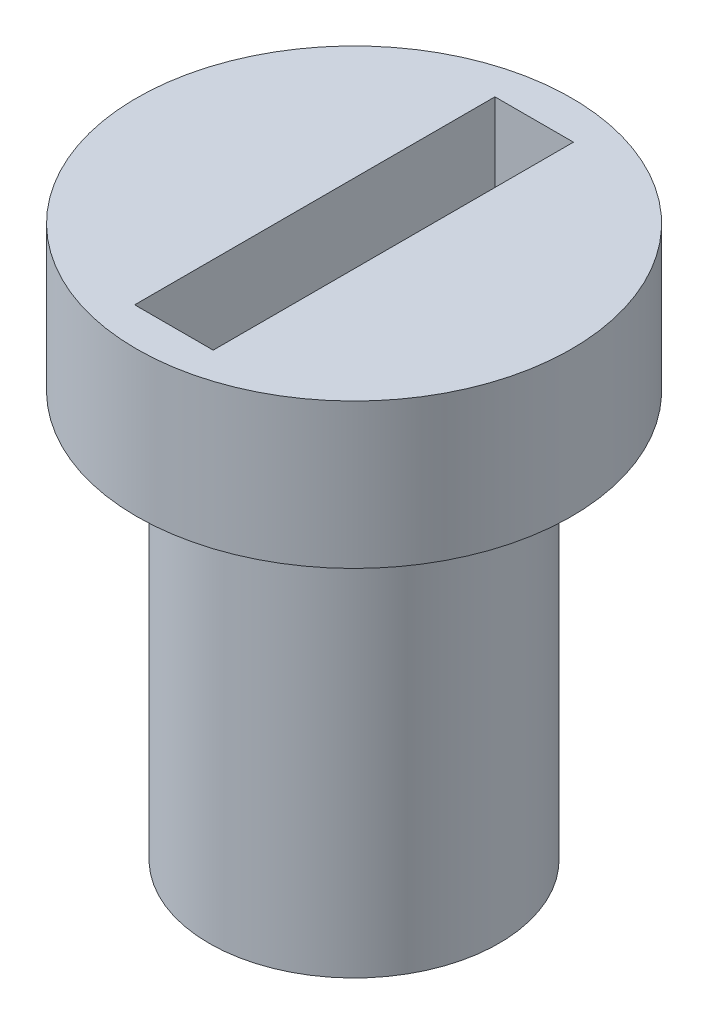
from build123d import *

# Parameters (mm, degrees)
SKETCH_1_R               = 7.5
EXTRUDE_1_DEPTH          = 5
SKETCH_2_R               = 5
EXTRUDE_2_DEPTH          = 14
CUT_EXTRUDE_1_DEPTH      = 22.760055147
CUT_EXTRUDE_1_DEPTH_BACK = 3
SKETCH_3_W               = 2.708105792
SKETCH_3_H               = 12.424551298


with BuildPart() as part:
    # 草图1 → 凸台-拉伸1 (new body)
    with BuildSketch(Plane(origin=(0, 0, 0), x_dir=(1, 0, 0), z_dir=(0, 1, 0))):
        with Locations(Location((0, 0, 0), (0, 0, 270))):
            Circle(SKETCH_1_R)
    extrude(amount=EXTRUDE_1_DEPTH)

    # 草图2 → 凸台-拉伸2 (add)
    with BuildSketch(Plane(origin=(0, 0, 0), x_dir=(-1, 0, 0), z_dir=(0, -1, 0))):
        with Locations(Location((0, 0, 0), (0, 0, 90))):
            Circle(SKETCH_2_R)
    extrude(amount=EXTRUDE_2_DEPTH)

    # 草图3 → 切除-拉伸1 (cut, two sides: drawn at the far end of the back side and taken through both)
    with BuildSketch(Plane(origin=(0, 5, 0), x_dir=(1, 0, 0), z_dir=(0, 1, 0)).offset(-CUT_EXTRUDE_1_DEPTH_BACK)):
        Rectangle(SKETCH_3_W, SKETCH_3_H)
    extrude(amount=CUT_EXTRUDE_1_DEPTH + CUT_EXTRUDE_1_DEPTH_BACK, mode=Mode.SUBTRACT)


solid = part.part
